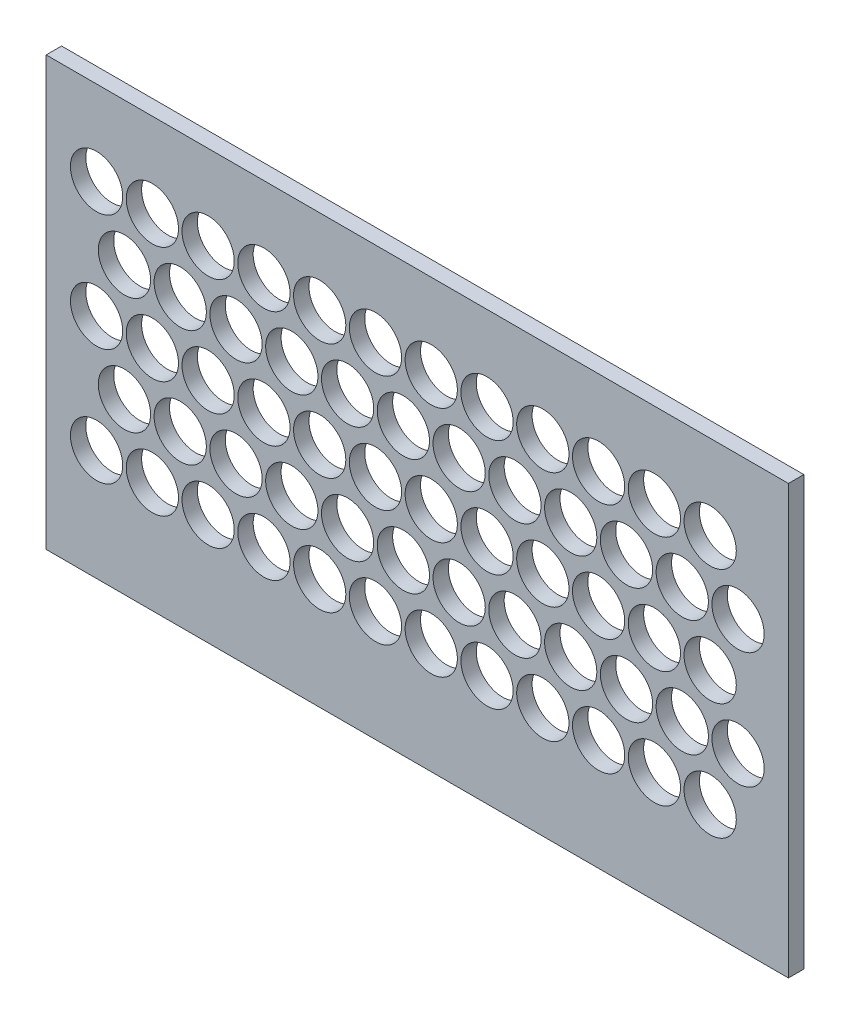
from build123d import *

# Parameters (mm, degrees)
SKETCH1_W                  = 306.05000007
SKETCH1_H                  = 173.4250001
BOSS_EXTRUDE1_DEPTH        = 6.35
SKETCH3_R                  = 10.775
CUT_EXTRUDE1_DEPTH         = 180.584865148
SKETCH4_R                  = 10.775
CUT_EXTRUDE2_DEPTH         = 180.584865148
LPATTERN1_COUNT            = 12
LPATTERN1_PITCH            = 23
LPATTERN3_COUNT            = 12
LPATTERN3_PITCH            = 23
LPATTERN2_COUNT            = 3
LPATTERN2_PITCH            = 48
LPATTERN2_COPY_1_SKETCH_R  = 10.775
LPATTERN2_COPY_1_DEPTH     = 180.584865148
LPATTERN2_COPY_2_SKETCH_R  = 10.775
LPATTERN2_COPY_2_DEPTH     = 180.584865148
LPATTERN2_COPY_3_SKETCH_R  = 10.775
LPATTERN2_COPY_3_DEPTH     = 180.584865148
LPATTERN2_COPY_4_SKETCH_R  = 10.775
LPATTERN2_COPY_4_DEPTH     = 180.584865148
LPATTERN2_COPY_5_SKETCH_R  = 10.775
LPATTERN2_COPY_5_DEPTH     = 180.584865148
LPATTERN2_COPY_6_SKETCH_R  = 10.775
LPATTERN2_COPY_6_DEPTH     = 180.584865148
LPATTERN2_COPY_7_SKETCH_R  = 10.775
LPATTERN2_COPY_7_DEPTH     = 180.584865148
LPATTERN2_COPY_8_SKETCH_R  = 10.775
LPATTERN2_COPY_8_DEPTH     = 180.584865148
LPATTERN2_COPY_9_SKETCH_R  = 10.775
LPATTERN2_COPY_9_DEPTH     = 180.584865148
LPATTERN2_COPY_10_SKETCH_R = 10.775
LPATTERN2_COPY_10_DEPTH    = 180.584865148
LPATTERN2_COPY_11_SKETCH_R = 10.775
LPATTERN2_COPY_11_DEPTH    = 180.584865148
LPATTERN2_COPY_12_SKETCH_R = 10.775
LPATTERN2_COPY_12_DEPTH    = 180.584865148
LPATTERN2_COPY_13_SKETCH_R = 10.775
LPATTERN2_COPY_13_DEPTH    = 180.584865148
LPATTERN2_COPY_14_SKETCH_R = 10.775
LPATTERN2_COPY_14_DEPTH    = 180.584865148
LPATTERN2_COPY_15_SKETCH_R = 10.775
LPATTERN2_COPY_15_DEPTH    = 180.584865148
LPATTERN2_COPY_16_SKETCH_R = 10.775
LPATTERN2_COPY_16_DEPTH    = 180.584865148
LPATTERN2_COPY_17_SKETCH_R = 10.775
LPATTERN2_COPY_17_DEPTH    = 180.584865148
LPATTERN2_COPY_18_SKETCH_R = 10.775
LPATTERN2_COPY_18_DEPTH    = 180.584865148
LPATTERN2_COPY_19_SKETCH_R = 10.775
LPATTERN2_COPY_19_DEPTH    = 180.584865148
LPATTERN2_COPY_20_SKETCH_R = 10.775
LPATTERN2_COPY_20_DEPTH    = 180.584865148
LPATTERN2_COPY_21_SKETCH_R = 10.775
LPATTERN2_COPY_21_DEPTH    = 180.584865148
LPATTERN2_COPY_22_SKETCH_R = 10.775
LPATTERN2_COPY_22_DEPTH    = 180.584865148
LPATTERN4_COUNT            = 2
LPATTERN4_PITCH            = 48
LPATTERN4_COPY_1_SKETCH_R  = 10.775
LPATTERN4_COPY_1_DEPTH     = 180.584865148
LPATTERN4_COPY_2_SKETCH_R  = 10.775
LPATTERN4_COPY_2_DEPTH     = 180.584865148
LPATTERN4_COPY_3_SKETCH_R  = 10.775
LPATTERN4_COPY_3_DEPTH     = 180.584865148
LPATTERN4_COPY_4_SKETCH_R  = 10.775
LPATTERN4_COPY_4_DEPTH     = 180.584865148
LPATTERN4_COPY_5_SKETCH_R  = 10.775
LPATTERN4_COPY_5_DEPTH     = 180.584865148
LPATTERN4_COPY_6_SKETCH_R  = 10.775
LPATTERN4_COPY_6_DEPTH     = 180.584865148
LPATTERN4_COPY_7_SKETCH_R  = 10.775
LPATTERN4_COPY_7_DEPTH     = 180.584865148
LPATTERN4_COPY_8_SKETCH_R  = 10.775
LPATTERN4_COPY_8_DEPTH     = 180.584865148
LPATTERN4_COPY_9_SKETCH_R  = 10.775
LPATTERN4_COPY_9_DEPTH     = 180.584865148
LPATTERN4_COPY_10_SKETCH_R = 10.775
LPATTERN4_COPY_10_DEPTH    = 180.584865148
LPATTERN4_COPY_11_SKETCH_R = 10.775
LPATTERN4_COPY_11_DEPTH    = 180.584865148
SKETCH13_W                 = 306.05000007
SKETCH13_H                 = 6.35
BOSS_EXTRUDE2_DEPTH        = 3.175


with BuildPart() as part:
    # Sketch1 → Boss-Extrude1 (new body)
    with BuildSketch(Plane.XY):
        with Locations((3.5e-08, -7.06250005)):
            Rectangle(SKETCH1_W, SKETCH1_H)
    extrude(amount=BOSS_EXTRUDE1_DEPTH)

    # Sketch3 → Cut-Extrude1 (cut, through all)
    with BuildSketch(Plane.XY.offset(6.35)):
        with Locations((-132.25, -48)):
            Circle(SKETCH3_R)
    cut_extrude1 = extrude(amount=-CUT_EXTRUDE1_DEPTH, mode=Mode.SUBTRACT)

    # Sketch4 → Cut-Extrude2 (cut, through all)
    with BuildSketch(Plane.XY.offset(6.35)):
        with Locations((-120.75, -24)):
            Circle(SKETCH4_R)
    cut_extrude2 = extrude(amount=-CUT_EXTRUDE2_DEPTH, mode=Mode.SUBTRACT)

    # LPattern1: Cut-Extrude1 ×12
    with Locations(*[(i * LPATTERN1_PITCH, 0, 0) for i in range(1, LPATTERN1_COUNT)]):
        add(cut_extrude1, mode=Mode.SUBTRACT)

    # LPattern3: Cut-Extrude2 ×12
    with Locations(*[(i * LPATTERN3_PITCH, 0, 0) for i in range(1, LPATTERN3_COUNT)]):
        add(cut_extrude2, mode=Mode.SUBTRACT)

    # LPattern2: Cut-Extrude1 ×3
    with Locations(*[(0, i * LPATTERN2_PITCH, 0) for i in range(1, LPATTERN2_COUNT)]):
        add(cut_extrude1, mode=Mode.SUBTRACT)

    # LPattern2 copy 1 sketch → LPattern2 copy 1 (cut, through all)
    with BuildSketch(Plane(origin=(23, 48, 6.35), x_dir=(1, 0, 0), z_dir=(0, 0, 1))):
        with Locations((-132.25, -48)):
            Circle(LPATTERN2_COPY_1_SKETCH_R)
    extrude(amount=-LPATTERN2_COPY_1_DEPTH, mode=Mode.SUBTRACT)

    # LPattern2 copy 2 sketch → LPattern2 copy 2 (cut, through all)
    with BuildSketch(Plane(origin=(23, 96, 6.35), x_dir=(1, 0, 0), z_dir=(0, 0, 1))):
        with Locations((-132.25, -48)):
            Circle(LPATTERN2_COPY_2_SKETCH_R)
    extrude(amount=-LPATTERN2_COPY_2_DEPTH, mode=Mode.SUBTRACT)

    # LPattern2 copy 3 sketch → LPattern2 copy 3 (cut, through all)
    with BuildSketch(Plane(origin=(46, 48, 6.35), x_dir=(1, 0, 0), z_dir=(0, 0, 1))):
        with Locations((-132.25, -48)):
            Circle(LPATTERN2_COPY_3_SKETCH_R)
    extrude(amount=-LPATTERN2_COPY_3_DEPTH, mode=Mode.SUBTRACT)

    # LPattern2 copy 4 sketch → LPattern2 copy 4 (cut, through all)
    with BuildSketch(Plane(origin=(46, 96, 6.35), x_dir=(1, 0, 0), z_dir=(0, 0, 1))):
        with Locations((-132.25, -48)):
            Circle(LPATTERN2_COPY_4_SKETCH_R)
    extrude(amount=-LPATTERN2_COPY_4_DEPTH, mode=Mode.SUBTRACT)

    # LPattern2 copy 5 sketch → LPattern2 copy 5 (cut, through all)
    with BuildSketch(Plane(origin=(69, 48, 6.35), x_dir=(1, 0, 0), z_dir=(0, 0, 1))):
        with Locations((-132.25, -48)):
            Circle(LPATTERN2_COPY_5_SKETCH_R)
    extrude(amount=-LPATTERN2_COPY_5_DEPTH, mode=Mode.SUBTRACT)

    # LPattern2 copy 6 sketch → LPattern2 copy 6 (cut, through all)
    with BuildSketch(Plane(origin=(69, 96, 6.35), x_dir=(1, 0, 0), z_dir=(0, 0, 1))):
        with Locations((-132.25, -48)):
            Circle(LPATTERN2_COPY_6_SKETCH_R)
    extrude(amount=-LPATTERN2_COPY_6_DEPTH, mode=Mode.SUBTRACT)

    # LPattern2 copy 7 sketch → LPattern2 copy 7 (cut, through all)
    with BuildSketch(Plane(origin=(92, 48, 6.35), x_dir=(1, 0, 0), z_dir=(0, 0, 1))):
        with Locations((-132.25, -48)):
            Circle(LPATTERN2_COPY_7_SKETCH_R)
    extrude(amount=-LPATTERN2_COPY_7_DEPTH, mode=Mode.SUBTRACT)

    # LPattern2 copy 8 sketch → LPattern2 copy 8 (cut, through all)
    with BuildSketch(Plane(origin=(92, 96, 6.35), x_dir=(1, 0, 0), z_dir=(0, 0, 1))):
        with Locations((-132.25, -48)):
            Circle(LPATTERN2_COPY_8_SKETCH_R)
    extrude(amount=-LPATTERN2_COPY_8_DEPTH, mode=Mode.SUBTRACT)

    # LPattern2 copy 9 sketch → LPattern2 copy 9 (cut, through all)
    with BuildSketch(Plane(origin=(115, 48, 6.35), x_dir=(1, 0, 0), z_dir=(0, 0, 1))):
        with Locations((-132.25, -48)):
            Circle(LPATTERN2_COPY_9_SKETCH_R)
    extrude(amount=-LPATTERN2_COPY_9_DEPTH, mode=Mode.SUBTRACT)

    # LPattern2 copy 10 sketch → LPattern2 copy 10 (cut, through all)
    with BuildSketch(Plane(origin=(115, 96, 6.35), x_dir=(1, 0, 0), z_dir=(0, 0, 1))):
        with Locations((-132.25, -48)):
            Circle(LPATTERN2_COPY_10_SKETCH_R)
    extrude(amount=-LPATTERN2_COPY_10_DEPTH, mode=Mode.SUBTRACT)

    # LPattern2 copy 11 sketch → LPattern2 copy 11 (cut, through all)
    with BuildSketch(Plane(origin=(138, 48, 6.35), x_dir=(1, 0, 0), z_dir=(0, 0, 1))):
        with Locations((-132.25, -48)):
            Circle(LPATTERN2_COPY_11_SKETCH_R)
    extrude(amount=-LPATTERN2_COPY_11_DEPTH, mode=Mode.SUBTRACT)

    # LPattern2 copy 12 sketch → LPattern2 copy 12 (cut, through all)
    with BuildSketch(Plane(origin=(138, 96, 6.35), x_dir=(1, 0, 0), z_dir=(0, 0, 1))):
        with Locations((-132.25, -48)):
            Circle(LPATTERN2_COPY_12_SKETCH_R)
    extrude(amount=-LPATTERN2_COPY_12_DEPTH, mode=Mode.SUBTRACT)

    # LPattern2 copy 13 sketch → LPattern2 copy 13 (cut, through all)
    with BuildSketch(Plane(origin=(161, 48, 6.35), x_dir=(1, 0, 0), z_dir=(0, 0, 1))):
        with Locations((-132.25, -48)):
            Circle(LPATTERN2_COPY_13_SKETCH_R)
    extrude(amount=-LPATTERN2_COPY_13_DEPTH, mode=Mode.SUBTRACT)

    # LPattern2 copy 14 sketch → LPattern2 copy 14 (cut, through all)
    with BuildSketch(Plane(origin=(161, 96, 6.35), x_dir=(1, 0, 0), z_dir=(0, 0, 1))):
        with Locations((-132.25, -48)):
            Circle(LPATTERN2_COPY_14_SKETCH_R)
    extrude(amount=-LPATTERN2_COPY_14_DEPTH, mode=Mode.SUBTRACT)

    # LPattern2 copy 15 sketch → LPattern2 copy 15 (cut, through all)
    with BuildSketch(Plane(origin=(184, 48, 6.35), x_dir=(1, 0, 0), z_dir=(0, 0, 1))):
        with Locations((-132.25, -48)):
            Circle(LPATTERN2_COPY_15_SKETCH_R)
    extrude(amount=-LPATTERN2_COPY_15_DEPTH, mode=Mode.SUBTRACT)

    # LPattern2 copy 16 sketch → LPattern2 copy 16 (cut, through all)
    with BuildSketch(Plane(origin=(184, 96, 6.35), x_dir=(1, 0, 0), z_dir=(0, 0, 1))):
        with Locations((-132.25, -48)):
            Circle(LPATTERN2_COPY_16_SKETCH_R)
    extrude(amount=-LPATTERN2_COPY_16_DEPTH, mode=Mode.SUBTRACT)

    # LPattern2 copy 17 sketch → LPattern2 copy 17 (cut, through all)
    with BuildSketch(Plane(origin=(207, 48, 6.35), x_dir=(1, 0, 0), z_dir=(0, 0, 1))):
        with Locations((-132.25, -48)):
            Circle(LPATTERN2_COPY_17_SKETCH_R)
    extrude(amount=-LPATTERN2_COPY_17_DEPTH, mode=Mode.SUBTRACT)

    # LPattern2 copy 18 sketch → LPattern2 copy 18 (cut, through all)
    with BuildSketch(Plane(origin=(207, 96, 6.35), x_dir=(1, 0, 0), z_dir=(0, 0, 1))):
        with Locations((-132.25, -48)):
            Circle(LPATTERN2_COPY_18_SKETCH_R)
    extrude(amount=-LPATTERN2_COPY_18_DEPTH, mode=Mode.SUBTRACT)

    # LPattern2 copy 19 sketch → LPattern2 copy 19 (cut, through all)
    with BuildSketch(Plane(origin=(230, 48, 6.35), x_dir=(1, 0, 0), z_dir=(0, 0, 1))):
        with Locations((-132.25, -48)):
            Circle(LPATTERN2_COPY_19_SKETCH_R)
    extrude(amount=-LPATTERN2_COPY_19_DEPTH, mode=Mode.SUBTRACT)

    # LPattern2 copy 20 sketch → LPattern2 copy 20 (cut, through all)
    with BuildSketch(Plane(origin=(230, 96, 6.35), x_dir=(1, 0, 0), z_dir=(0, 0, 1))):
        with Locations((-132.25, -48)):
            Circle(LPATTERN2_COPY_20_SKETCH_R)
    extrude(amount=-LPATTERN2_COPY_20_DEPTH, mode=Mode.SUBTRACT)

    # LPattern2 copy 21 sketch → LPattern2 copy 21 (cut, through all)
    with BuildSketch(Plane(origin=(253, 48, 6.35), x_dir=(1, 0, 0), z_dir=(0, 0, 1))):
        with Locations((-132.25, -48)):
            Circle(LPATTERN2_COPY_21_SKETCH_R)
    extrude(amount=-LPATTERN2_COPY_21_DEPTH, mode=Mode.SUBTRACT)

    # LPattern2 copy 22 sketch → LPattern2 copy 22 (cut, through all)
    with BuildSketch(Plane(origin=(253, 96, 6.35), x_dir=(1, 0, 0), z_dir=(0, 0, 1))):
        with Locations((-132.25, -48)):
            Circle(LPATTERN2_COPY_22_SKETCH_R)
    extrude(amount=-LPATTERN2_COPY_22_DEPTH, mode=Mode.SUBTRACT)

    # LPattern4: Cut-Extrude2 ×2
    with Locations(*[(0, i * LPATTERN4_PITCH, 0) for i in range(1, LPATTERN4_COUNT)]):
        add(cut_extrude2, mode=Mode.SUBTRACT)

    # LPattern4 copy 1 sketch → LPattern4 copy 1 (cut, through all)
    with BuildSketch(Plane(origin=(23, 48, 6.35), x_dir=(1, 0, 0), z_dir=(0, 0, 1))):
        with Locations((-120.75, -24)):
            Circle(LPATTERN4_COPY_1_SKETCH_R)
    extrude(amount=-LPATTERN4_COPY_1_DEPTH, mode=Mode.SUBTRACT)

    # LPattern4 copy 2 sketch → LPattern4 copy 2 (cut, through all)
    with BuildSketch(Plane(origin=(46, 48, 6.35), x_dir=(1, 0, 0), z_dir=(0, 0, 1))):
        with Locations((-120.75, -24)):
            Circle(LPATTERN4_COPY_2_SKETCH_R)
    extrude(amount=-LPATTERN4_COPY_2_DEPTH, mode=Mode.SUBTRACT)

    # LPattern4 copy 3 sketch → LPattern4 copy 3 (cut, through all)
    with BuildSketch(Plane(origin=(69, 48, 6.35), x_dir=(1, 0, 0), z_dir=(0, 0, 1))):
        with Locations((-120.75, -24)):
            Circle(LPATTERN4_COPY_3_SKETCH_R)
    extrude(amount=-LPATTERN4_COPY_3_DEPTH, mode=Mode.SUBTRACT)

    # LPattern4 copy 4 sketch → LPattern4 copy 4 (cut, through all)
    with BuildSketch(Plane(origin=(92, 48, 6.35), x_dir=(1, 0, 0), z_dir=(0, 0, 1))):
        with Locations((-120.75, -24)):
            Circle(LPATTERN4_COPY_4_SKETCH_R)
    extrude(amount=-LPATTERN4_COPY_4_DEPTH, mode=Mode.SUBTRACT)

    # LPattern4 copy 5 sketch → LPattern4 copy 5 (cut, through all)
    with BuildSketch(Plane(origin=(115, 48, 6.35), x_dir=(1, 0, 0), z_dir=(0, 0, 1))):
        with Locations((-120.75, -24)):
            Circle(LPATTERN4_COPY_5_SKETCH_R)
    extrude(amount=-LPATTERN4_COPY_5_DEPTH, mode=Mode.SUBTRACT)

    # LPattern4 copy 6 sketch → LPattern4 copy 6 (cut, through all)
    with BuildSketch(Plane(origin=(138, 48, 6.35), x_dir=(1, 0, 0), z_dir=(0, 0, 1))):
        with Locations((-120.75, -24)):
            Circle(LPATTERN4_COPY_6_SKETCH_R)
    extrude(amount=-LPATTERN4_COPY_6_DEPTH, mode=Mode.SUBTRACT)

    # LPattern4 copy 7 sketch → LPattern4 copy 7 (cut, through all)
    with BuildSketch(Plane(origin=(161, 48, 6.35), x_dir=(1, 0, 0), z_dir=(0, 0, 1))):
        with Locations((-120.75, -24)):
            Circle(LPATTERN4_COPY_7_SKETCH_R)
    extrude(amount=-LPATTERN4_COPY_7_DEPTH, mode=Mode.SUBTRACT)

    # LPattern4 copy 8 sketch → LPattern4 copy 8 (cut, through all)
    with BuildSketch(Plane(origin=(184, 48, 6.35), x_dir=(1, 0, 0), z_dir=(0, 0, 1))):
        with Locations((-120.75, -24)):
            Circle(LPATTERN4_COPY_8_SKETCH_R)
    extrude(amount=-LPATTERN4_COPY_8_DEPTH, mode=Mode.SUBTRACT)

    # LPattern4 copy 9 sketch → LPattern4 copy 9 (cut, through all)
    with BuildSketch(Plane(origin=(207, 48, 6.35), x_dir=(1, 0, 0), z_dir=(0, 0, 1))):
        with Locations((-120.75, -24)):
            Circle(LPATTERN4_COPY_9_SKETCH_R)
    extrude(amount=-LPATTERN4_COPY_9_DEPTH, mode=Mode.SUBTRACT)

    # LPattern4 copy 10 sketch → LPattern4 copy 10 (cut, through all)
    with BuildSketch(Plane(origin=(230, 48, 6.35), x_dir=(1, 0, 0), z_dir=(0, 0, 1))):
        with Locations((-120.75, -24)):
            Circle(LPATTERN4_COPY_10_SKETCH_R)
    extrude(amount=-LPATTERN4_COPY_10_DEPTH, mode=Mode.SUBTRACT)

    # LPattern4 copy 11 sketch → LPattern4 copy 11 (cut, through all)
    with BuildSketch(Plane(origin=(253, 48, 6.35), x_dir=(1, 0, 0), z_dir=(0, 0, 1))):
        with Locations((-120.75, -24)):
            Circle(LPATTERN4_COPY_11_SKETCH_R)
    extrude(amount=-LPATTERN4_COPY_11_DEPTH, mode=Mode.SUBTRACT)

    # Sketch13 → Boss-Extrude2 (add)
    with BuildSketch(Plane(origin=(0, 79.65, 0), x_dir=(1, 0, 0), z_dir=(0, 1, 0))):
        with Locations((3.5e-08, -3.175)):
            Rectangle(SKETCH13_W, SKETCH13_H)
    extrude(amount=BOSS_EXTRUDE2_DEPTH)


solid = part.part
